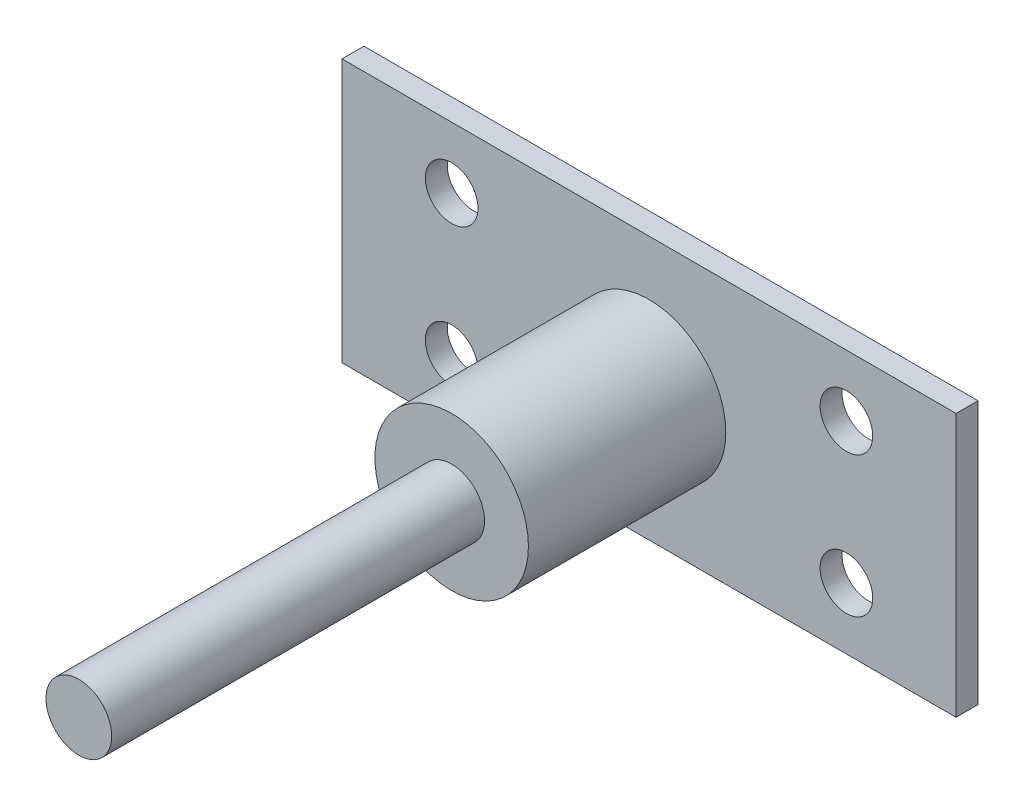
from build123d import *

# Parameters (mm, degrees)
SKETCH1_W           = 140
SKETCH1_H           = 60
SKETCH1_R           = 6
BOSS_EXTRUDE1_DEPTH = 5
SKETCH2_R           = 17.5
BOSS_EXTRUDE2_DEPTH = 45
SKETCH3_R           = 7.5
BOSS_EXTRUDE3_DEPTH = 85


with BuildPart() as part:
    # Sketch1 → Boss-Extrude1 (new body)
    with BuildSketch(Plane.XY):
        Rectangle(SKETCH1_W, SKETCH1_H)
        with Locations((-45, 16)):
            Circle(SKETCH1_R, mode=Mode.SUBTRACT)
        with Locations((-45, -16)):
            Circle(SKETCH1_R, mode=Mode.SUBTRACT)
        with Locations((45, -16)):
            Circle(SKETCH1_R, mode=Mode.SUBTRACT)
        with Locations((45, 16)):
            Circle(SKETCH1_R, mode=Mode.SUBTRACT)
    extrude(amount=BOSS_EXTRUDE1_DEPTH)

    # Sketch2 → Boss-Extrude2 (add)
    with BuildSketch(Plane.XY.offset(5)):
        Circle(SKETCH2_R)
    extrude(amount=BOSS_EXTRUDE2_DEPTH)

    # Sketch3 → Boss-Extrude3 (add)
    with BuildSketch(Plane.XY.offset(50)):
        Circle(SKETCH3_R)
    extrude(amount=BOSS_EXTRUDE3_DEPTH)


solid = part.part
